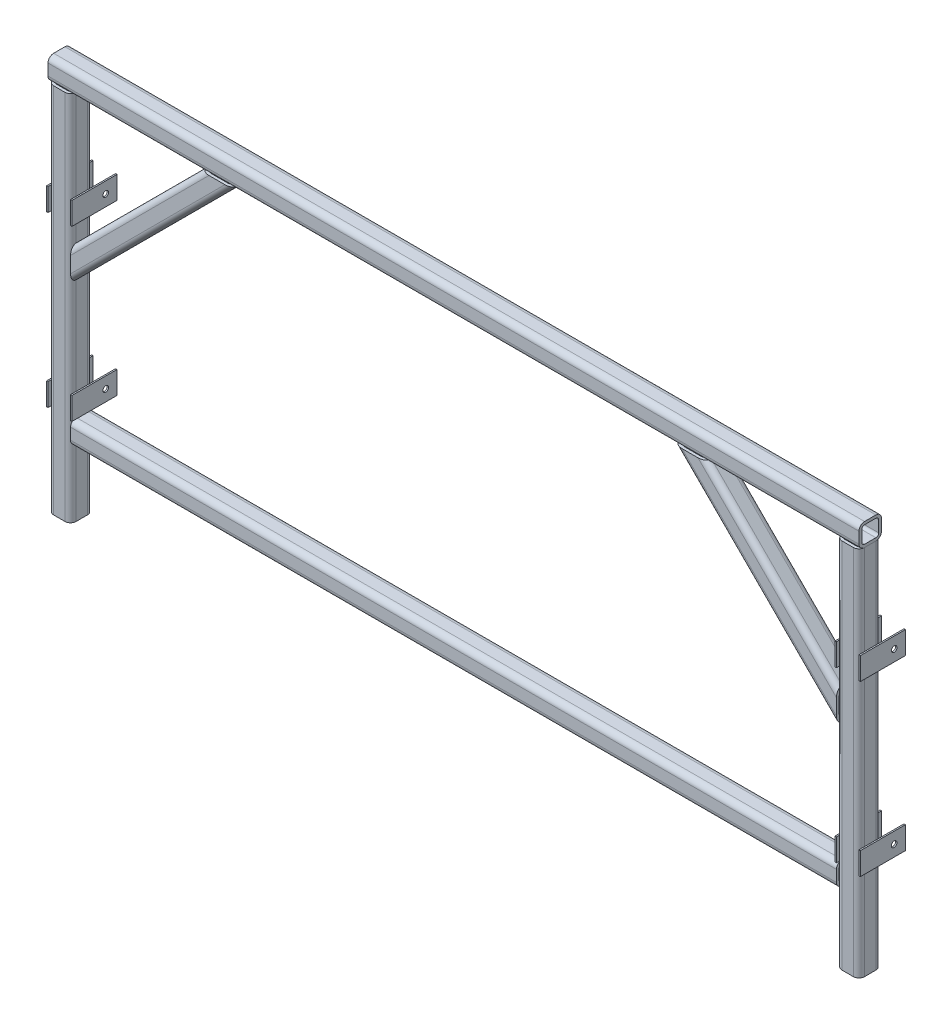
from build123d import *

# Parameters (mm, degrees)
STRUCTURAL_MEMBER1_DEPTH        = 889
STRUCTURAL_MEMBER1_2_DEPTH      = 1803.4
STRUCTURAL_MEMBER1_2_DEPTH_BACK = 1
STRUCTURAL_MEMBER1_3_DEPTH      = 864.6
STRUCTURAL_MEMBER1_4_DEPTH      = 612.657416233
STRUCTURAL_MEMBER1_5_DEPTH      = 612.657416233
STRUCTURAL_MEMBER1_6_DEPTH      = 1780
BODY_START                      = 25.4
BODY_2_RUN_ON_DEPTH             = 50.8
SKETCH12_W                      = 101.6
SKETCH12_H                      = 50.8
SKETCH12_R                      = 6.35
BOSS_EXTRUDE1_DEPTH             = 3.175
BOSS_EXTRUDE1_2_DEPTH           = 3.175
LPATTERN2_COUNT                 = 2
LPATTERN2_PITCH                 = 1778
MIRROR11_COPY_1_SKETCH_W        = 101.6
MIRROR11_COPY_1_SKETCH_H        = 50.8
MIRROR11_COPY_1_SKETCH_R        = 6.35
MIRROR11_COPY_1_DEPTH           = 3.175
MIRROR11_COPY_2_SKETCH_W        = 101.6
MIRROR11_COPY_2_SKETCH_H        = 50.8
MIRROR11_COPY_2_SKETCH_R        = 6.35
MIRROR11_COPY_2_DEPTH           = 3.175


with BuildPart() as part:
    # Sketch11 on segment 1 (carried to segment 1) → Structural Member1 (new body)
    with BuildSketch(Plane(origin=(-889, -431.8, 0), x_dir=(-1, 0, 0), z_dir=(0, 1, 0))):
        with BuildLine():
            Line((-12.7, -25.4), (12.7, -25.4))
            ThreePointArc((12.7, -25.4), (21.680256121, -21.680256121), (25.4, -12.7))
            Line((25.4, -12.7), (25.4, 12.7))
            ThreePointArc((25.4, 12.7), (21.680256121, 21.680256121), (12.7, 25.4))
            Line((12.7, 25.4), (-12.7, 25.4))
            ThreePointArc((-12.7, 25.4), (-21.680256121, 21.680256121), (-25.4, 12.7))
            Line((-25.4, 12.7), (-25.4, -12.7))
            ThreePointArc((-25.4, -12.7), (-21.680256121, -21.680256121), (-12.7, -25.4))
        make_face()
        with BuildLine():
            Line((-12.7, -19.05), (12.7, -19.05))
            ThreePointArc((12.7, -19.05), (17.190128061, -17.190128061), (19.05, -12.7))
            Line((19.05, -12.7), (19.05, 12.7))
            ThreePointArc((19.05, 12.7), (17.190128061, 17.190128061), (12.7, 19.05))
            Line((12.7, 19.05), (-12.7, 19.05))
            ThreePointArc((-12.7, 19.05), (-17.190128061, 17.190128061), (-19.05, 12.7))
            Line((-19.05, 12.7), (-19.05, -12.7))
            ThreePointArc((-19.05, -12.7), (-17.190128061, -17.190128061), (-12.7, -19.05))
        make_face(mode=Mode.SUBTRACT)
    extrude(amount=STRUCTURAL_MEMBER1_DEPTH)

    # Trim/Extend2
    split(bisect_by=Plane.XZ.offset(-406.4), keep=Keep.TOP)

    # Mirror11 copy 1 sketch → Mirror11 copy 1 (add)
    with BuildSketch(Plane(origin=(-914.4, 0, 0), x_dir=(0, 0, -1), z_dir=(-1, 0, 0))):
        with Locations((25.4, 203.2)):
            Rectangle(MIRROR11_COPY_1_SKETCH_W, MIRROR11_COPY_1_SKETCH_H)
        with Locations((50.8, 203.2)):
            Circle(MIRROR11_COPY_1_SKETCH_R, mode=Mode.SUBTRACT)
    extrude(amount=MIRROR11_COPY_1_DEPTH)

    # Mirror11 copy 2 sketch → Mirror11 copy 2 (add)
    with BuildSketch(Plane(origin=(-914.4, 0, 0), x_dir=(0, 0, -1), z_dir=(-1, 0, 0))):
        with Locations((25.4, -177.8)):
            Rectangle(MIRROR11_COPY_2_SKETCH_W, MIRROR11_COPY_2_SKETCH_H)
        with Locations((50.8, -177.8)):
            Circle(MIRROR11_COPY_2_SKETCH_R, mode=Mode.SUBTRACT)
    extrude(amount=MIRROR11_COPY_2_DEPTH)


with BuildPart() as body_2:
    # Sketch11 → Structural Member1 2 (new, two sides: drawn at the far end of the back side and taken through both)
    with BuildSketch(Plane(origin=(-889, 431.8, 0), x_dir=(0, 1, 0), z_dir=(1, 0, 0)).offset(-STRUCTURAL_MEMBER1_2_DEPTH_BACK)):
        with BuildLine():
            Line((-12.7, -25.4), (12.7, -25.4))
            ThreePointArc((12.7, -25.4), (21.680256121, -21.680256121), (25.4, -12.7))
            Line((25.4, -12.7), (25.4, 12.7))
            ThreePointArc((25.4, 12.7), (21.680256121, 21.680256121), (12.7, 25.4))
            Line((12.7, 25.4), (-12.7, 25.4))
            ThreePointArc((-12.7, 25.4), (-21.680256121, 21.680256121), (-25.4, 12.7))
            Line((-25.4, 12.7), (-25.4, -12.7))
            ThreePointArc((-25.4, -12.7), (-21.680256121, -21.680256121), (-12.7, -25.4))
        make_face()
        with BuildLine():
            Line((-12.7, -19.05), (12.7, -19.05))
            ThreePointArc((12.7, -19.05), (17.190128061, -17.190128061), (19.05, -12.7))
            Line((19.05, -12.7), (19.05, 12.7))
            ThreePointArc((19.05, 12.7), (17.190128061, 17.190128061), (12.7, 19.05))
            Line((12.7, 19.05), (-12.7, 19.05))
            ThreePointArc((-12.7, 19.05), (-17.190128061, 17.190128061), (-19.05, 12.7))
            Line((-19.05, 12.7), (-19.05, -12.7))
            ThreePointArc((-19.05, -12.7), (-17.190128061, -17.190128061), (-12.7, -19.05))
        make_face(mode=Mode.SUBTRACT)
    extrude(amount=STRUCTURAL_MEMBER1_2_DEPTH + STRUCTURAL_MEMBER1_2_DEPTH_BACK)

    # Structural Member1 2 end butt 1
    split(bisect_by=Plane(origin=(-863.6, 431.8, 0), x_dir=(0, 1, 0), z_dir=(1, 0, 0)), keep=Keep.TOP)

    # Sketch11 → body 2 run on (add)
    with BuildSketch(Plane(origin=(-889, 431.8, 0), x_dir=(0, 1, 0), z_dir=(1, 0, 0)).offset(BODY_START)):
        with BuildLine():
            Line((-12.7, -25.4), (12.7, -25.4))
            ThreePointArc((12.7, -25.4), (21.680256121, -21.680256121), (25.4, -12.7))
            Line((25.4, -12.7), (25.4, 12.7))
            ThreePointArc((25.4, 12.7), (21.680256121, 21.680256121), (12.7, 25.4))
            Line((12.7, 25.4), (-12.7, 25.4))
            ThreePointArc((-12.7, 25.4), (-21.680256121, 21.680256121), (-25.4, 12.7))
            Line((-25.4, 12.7), (-25.4, -12.7))
            ThreePointArc((-25.4, -12.7), (-21.680256121, -21.680256121), (-12.7, -25.4))
        make_face()
        with BuildLine():
            Line((-12.7, -19.05), (12.7, -19.05))
            ThreePointArc((12.7, -19.05), (17.190128061, -17.190128061), (19.05, -12.7))
            Line((19.05, -12.7), (19.05, 12.7))
            ThreePointArc((19.05, 12.7), (17.190128061, 17.190128061), (12.7, 19.05))
            Line((12.7, 19.05), (-12.7, 19.05))
            ThreePointArc((-12.7, 19.05), (-17.190128061, 17.190128061), (-19.05, 12.7))
            Line((-19.05, 12.7), (-19.05, -12.7))
            ThreePointArc((-19.05, -12.7), (-17.190128061, -17.190128061), (-12.7, -19.05))
        make_face(mode=Mode.SUBTRACT)
    extrude(amount=-BODY_2_RUN_ON_DEPTH)


with BuildPart() as body_3:
    # Sketch11 on segment 3 (carried to segment 3) → Structural Member1 3 (new body)
    with BuildSketch(Plane(origin=(889, 432.8, 0), x_dir=(1, 0, 0), z_dir=(0, -1, 0))):
        with BuildLine():
            Line((-12.7, -25.4), (12.7, -25.4))
            ThreePointArc((12.7, -25.4), (21.680256121, -21.680256121), (25.4, -12.7))
            Line((25.4, -12.7), (25.4, 12.7))
            ThreePointArc((25.4, 12.7), (21.680256121, 21.680256121), (12.7, 25.4))
            Line((12.7, 25.4), (-12.7, 25.4))
            ThreePointArc((-12.7, 25.4), (-21.680256121, 21.680256121), (-25.4, 12.7))
            Line((-25.4, 12.7), (-25.4, -12.7))
            ThreePointArc((-25.4, -12.7), (-21.680256121, -21.680256121), (-12.7, -25.4))
        make_face()
        with BuildLine():
            Line((-12.7, -19.05), (12.7, -19.05))
            ThreePointArc((12.7, -19.05), (17.190128061, -17.190128061), (19.05, -12.7))
            Line((19.05, -12.7), (19.05, 12.7))
            ThreePointArc((19.05, 12.7), (17.190128061, 17.190128061), (12.7, 19.05))
            Line((12.7, 19.05), (-12.7, 19.05))
            ThreePointArc((-12.7, 19.05), (-17.190128061, 17.190128061), (-19.05, 12.7))
            Line((-19.05, 12.7), (-19.05, -12.7))
            ThreePointArc((-19.05, -12.7), (-17.190128061, -17.190128061), (-12.7, -19.05))
        make_face(mode=Mode.SUBTRACT)
    extrude(amount=STRUCTURAL_MEMBER1_3_DEPTH)

    # Structural Member1 3 end butt 1
    split(bisect_by=Plane(origin=(889, 406.4, 0), x_dir=(1, 0, 0), z_dir=(0, -1, 0)), keep=Keep.TOP)


with BuildPart() as body_4:
    # Sketch11 on segment 4 (carried to segment 4) → Structural Member1 4 (new body)
    with BuildSketch(Plane(origin=(-481.892893219, 457.907106781, 0), x_dir=(0.707106781, -0.707106781, 0), z_dir=(-0.707106781, -0.707106781, 0))):
        with BuildLine():
            Line((-12.7, -25.4), (12.7, -25.4))
            ThreePointArc((12.7, -25.4), (21.680256121, -21.680256121), (25.4, -12.7))
            Line((25.4, -12.7), (25.4, 12.7))
            ThreePointArc((25.4, 12.7), (21.680256121, 21.680256121), (12.7, 25.4))
            Line((12.7, 25.4), (-12.7, 25.4))
            ThreePointArc((-12.7, 25.4), (-21.680256121, 21.680256121), (-25.4, 12.7))
            Line((-25.4, 12.7), (-25.4, -12.7))
            ThreePointArc((-25.4, -12.7), (-21.680256121, -21.680256121), (-12.7, -25.4))
        make_face()
        with BuildLine():
            Line((-12.7, -19.05), (12.7, -19.05))
            ThreePointArc((12.7, -19.05), (17.190128061, -17.190128061), (19.05, -12.7))
            Line((19.05, -12.7), (19.05, 12.7))
            ThreePointArc((19.05, 12.7), (17.190128061, 17.190128061), (12.7, 19.05))
            Line((12.7, 19.05), (-12.7, 19.05))
            ThreePointArc((-12.7, 19.05), (-17.190128061, 17.190128061), (-19.05, 12.7))
            Line((-19.05, 12.7), (-19.05, -12.7))
            ThreePointArc((-19.05, -12.7), (-17.190128061, -17.190128061), (-12.7, -19.05))
        make_face(mode=Mode.SUBTRACT)
    extrude(amount=STRUCTURAL_MEMBER1_4_DEPTH)

    # Structural Member1 4 end butt 1
    split(bisect_by=Plane(origin=(-508, 406.4, 0), x_dir=(1, 0, 0), z_dir=(0, -1, 0)), keep=Keep.TOP)

    # Structural Member1 4 end butt 2
    split(bisect_by=Plane(origin=(-863.6, 50.8, 0), x_dir=(0, 1, 0), z_dir=(1, 0, 0)), keep=Keep.TOP)


with BuildPart() as body_5:
    # Sketch11 on segment 5 (carried to segment 5) → Structural Member1 5 (new body)
    with BuildSketch(Plane(origin=(481.892893219, 457.907106781, 0), x_dir=(0.707106781, 0.707106781, 0), z_dir=(0.707106781, -0.707106781, 0))):
        with BuildLine():
            Line((-12.7, -25.4), (12.7, -25.4))
            ThreePointArc((12.7, -25.4), (21.680256121, -21.680256121), (25.4, -12.7))
            Line((25.4, -12.7), (25.4, 12.7))
            ThreePointArc((25.4, 12.7), (21.680256121, 21.680256121), (12.7, 25.4))
            Line((12.7, 25.4), (-12.7, 25.4))
            ThreePointArc((-12.7, 25.4), (-21.680256121, 21.680256121), (-25.4, 12.7))
            Line((-25.4, 12.7), (-25.4, -12.7))
            ThreePointArc((-25.4, -12.7), (-21.680256121, -21.680256121), (-12.7, -25.4))
        make_face()
        with BuildLine():
            Line((-12.7, -19.05), (12.7, -19.05))
            ThreePointArc((12.7, -19.05), (17.190128061, -17.190128061), (19.05, -12.7))
            Line((19.05, -12.7), (19.05, 12.7))
            ThreePointArc((19.05, 12.7), (17.190128061, 17.190128061), (12.7, 19.05))
            Line((12.7, 19.05), (-12.7, 19.05))
            ThreePointArc((-12.7, 19.05), (-17.190128061, 17.190128061), (-19.05, 12.7))
            Line((-19.05, 12.7), (-19.05, -12.7))
            ThreePointArc((-19.05, -12.7), (-17.190128061, -17.190128061), (-12.7, -19.05))
        make_face(mode=Mode.SUBTRACT)
    extrude(amount=STRUCTURAL_MEMBER1_5_DEPTH)

    # Structural Member1 5 end butt 1
    split(bisect_by=Plane(origin=(508, 406.4, 0), x_dir=(1, 0, 0), z_dir=(0, -1, 0)), keep=Keep.TOP)

    # Structural Member1 5 end butt 2
    split(bisect_by=Plane(origin=(863.6, 50.8, 0), x_dir=(0, -1, 0), z_dir=(-1, 0, 0)), keep=Keep.TOP)


with BuildPart() as body_6:
    # Sketch11 on segment 6 (carried to segment 6) → Structural Member1 6 (new body)
    with BuildSketch(Plane(origin=(-890, -254, 0), x_dir=(0, 1, 0), z_dir=(1, 0, 0))):
        with BuildLine():
            Line((-12.7, -25.4), (12.7, -25.4))
            ThreePointArc((12.7, -25.4), (21.680256121, -21.680256121), (25.4, -12.7))
            Line((25.4, -12.7), (25.4, 12.7))
            ThreePointArc((25.4, 12.7), (21.680256121, 21.680256121), (12.7, 25.4))
            Line((12.7, 25.4), (-12.7, 25.4))
            ThreePointArc((-12.7, 25.4), (-21.680256121, 21.680256121), (-25.4, 12.7))
            Line((-25.4, 12.7), (-25.4, -12.7))
            ThreePointArc((-25.4, -12.7), (-21.680256121, -21.680256121), (-12.7, -25.4))
        make_face()
        with BuildLine():
            Line((-12.7, -19.05), (12.7, -19.05))
            ThreePointArc((12.7, -19.05), (17.190128061, -17.190128061), (19.05, -12.7))
            Line((19.05, -12.7), (19.05, 12.7))
            ThreePointArc((19.05, 12.7), (17.190128061, 17.190128061), (12.7, 19.05))
            Line((12.7, 19.05), (-12.7, 19.05))
            ThreePointArc((-12.7, 19.05), (-17.190128061, 17.190128061), (-19.05, 12.7))
            Line((-19.05, 12.7), (-19.05, -12.7))
            ThreePointArc((-19.05, -12.7), (-17.190128061, -17.190128061), (-12.7, -19.05))
        make_face(mode=Mode.SUBTRACT)
    extrude(amount=STRUCTURAL_MEMBER1_6_DEPTH)

    # Structural Member1 6 end butt 1
    split(bisect_by=Plane(origin=(-863.6, -254, 0), x_dir=(0, 1, 0), z_dir=(1, 0, 0)), keep=Keep.TOP)

    # Structural Member1 6 end butt 2
    split(bisect_by=Plane(origin=(863.6, -254, 0), x_dir=(0, -1, 0), z_dir=(-1, 0, 0)), keep=Keep.TOP)


with BuildPart() as body_7:
    # Sketch12 → Boss-Extrude1 (new body)
    with BuildSketch(Plane(origin=(914.4, 0, 0), x_dir=(0, 0, -1), z_dir=(1, 0, 0))):
        with Locations((25.4, -203.2)):
            Rectangle(SKETCH12_W, SKETCH12_H)
        with Locations((50.8, -203.2)):
            Circle(SKETCH12_R, mode=Mode.SUBTRACT)
    boss_extrude1 = extrude(amount=BOSS_EXTRUDE1_DEPTH)


with BuildPart() as body_8:
    # Sketch12 → Boss-Extrude1 2 (new body)
    with BuildSketch(Plane(origin=(914.4, 0, 0), x_dir=(0, 0, -1), z_dir=(1, 0, 0))):
        with Locations((25.4, 177.8)):
            Rectangle(SKETCH12_W, SKETCH12_H)
        with Locations(Location((50.8, 177.8, 0), (0, 0, 180))):
            Circle(SKETCH12_R, mode=Mode.SUBTRACT)
    boss_extrude1_2 = extrude(amount=BOSS_EXTRUDE1_2_DEPTH)


with BuildPart() as body_3_1:
    add(body_3.part)

    add(body_6.part)  # Mirror1 merges body 6
    # Mirror1: Boss-Extrude1, Boss-Extrude1 2 across plane
    add(boss_extrude1.mirror(Plane(origin=(889, 0, 0), x_dir=(0, 0, 1), z_dir=(1, 0, 0))))
    add(boss_extrude1_2.mirror(Plane(origin=(889, 0, 0), x_dir=(0, 0, 1), z_dir=(1, 0, 0))))


with BuildPart() as lpattern2_1:
    # LPattern2: Boss-Extrude1, Boss-Extrude1 2 ×2
    with Locations(*[(-i * LPATTERN2_PITCH, 0, 0) for i in range(1, LPATTERN2_COUNT)]):
        add(boss_extrude1)
        add(boss_extrude1_2)


solid = Compound([part.part, body_2.part, body_4.part, body_5.part, body_7.part, body_8.part, body_3_1.part, lpattern2_1.part])
